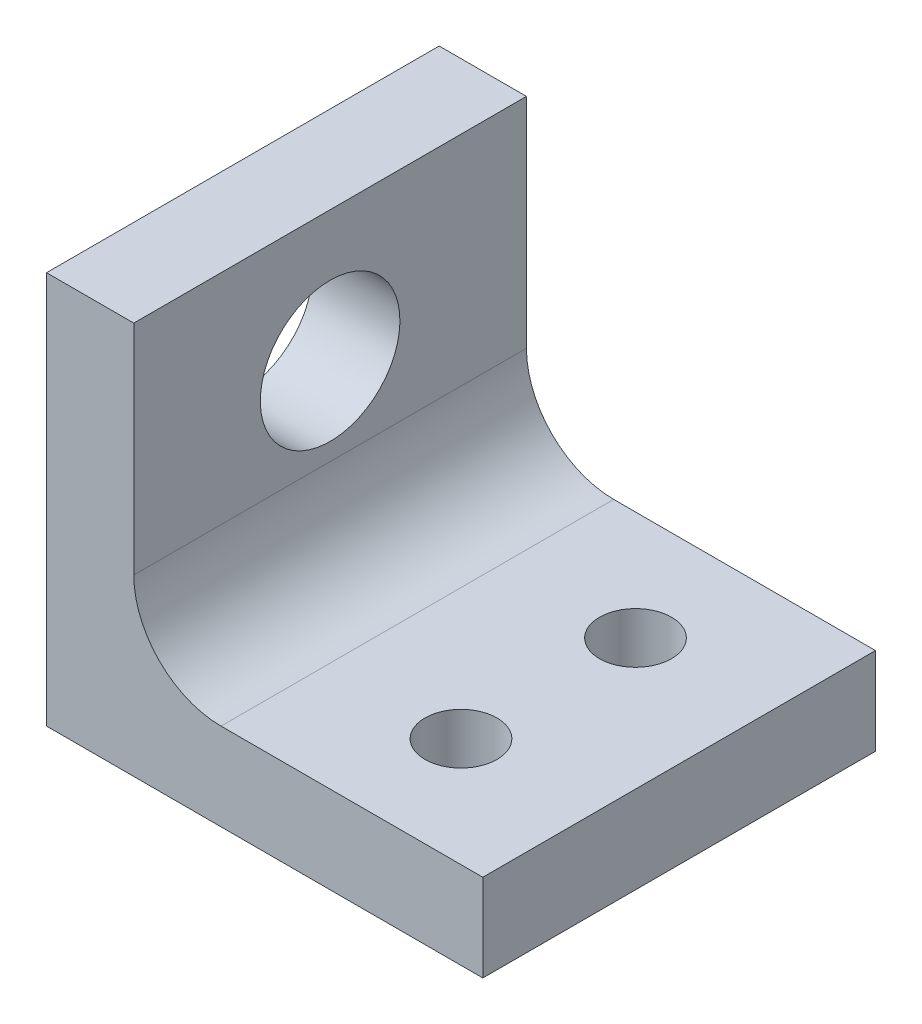
from build123d import *

# Parameters (mm, degrees)
BOSS_EXTRUDE1_DEPTH = 18
SKETCH2_R           = 3.2
CUT_EXTRUDE1_DEPTH  = 25
FILLET1_R           = 4
SKETCH3_R           = 1.65
CUT_EXTRUDE2_DEPTH  = 25


with BuildPart() as part:
    # Sketch1 → Boss-Extrude1 (new body)
    with BuildSketch(Plane.XY):
        Polygon((0, 0), (0, 18), (4, 18), (4, 4), (20, 4), (20, 0), align=None)
    extrude(amount=BOSS_EXTRUDE1_DEPTH)

    # Sketch2 → Cut-Extrude1 (cut)
    with BuildSketch(Plane(origin=(4, 0, 0), x_dir=(0, 0, -1), z_dir=(1, 0, 0))):
        with Locations(Location((-9, 12, 0), (0, 0, 90))):
            Circle(SKETCH2_R)
    extrude(amount=-CUT_EXTRUDE1_DEPTH, mode=Mode.SUBTRACT)

    # Fillet1
    fillet1_edges = [part.edges().sort_by_distance(p)[0] for p in [
        (4, 4, 9),
    ]]
    fillet(fillet1_edges, radius=FILLET1_R)

    # Sketch3 → Cut-Extrude2 (cut)
    with BuildSketch(Plane(origin=(0, 4, 0), x_dir=(1, 0, 0), z_dir=(0, 1, 0))):
        with Locations(Location((14, -5, 0), (0, 0, 180))):
            Circle(SKETCH3_R)
        with Locations(Location((14, -13, 0), (0, 0, 180))):
            Circle(SKETCH3_R)
    extrude(amount=-CUT_EXTRUDE2_DEPTH, mode=Mode.SUBTRACT)


solid = part.part
